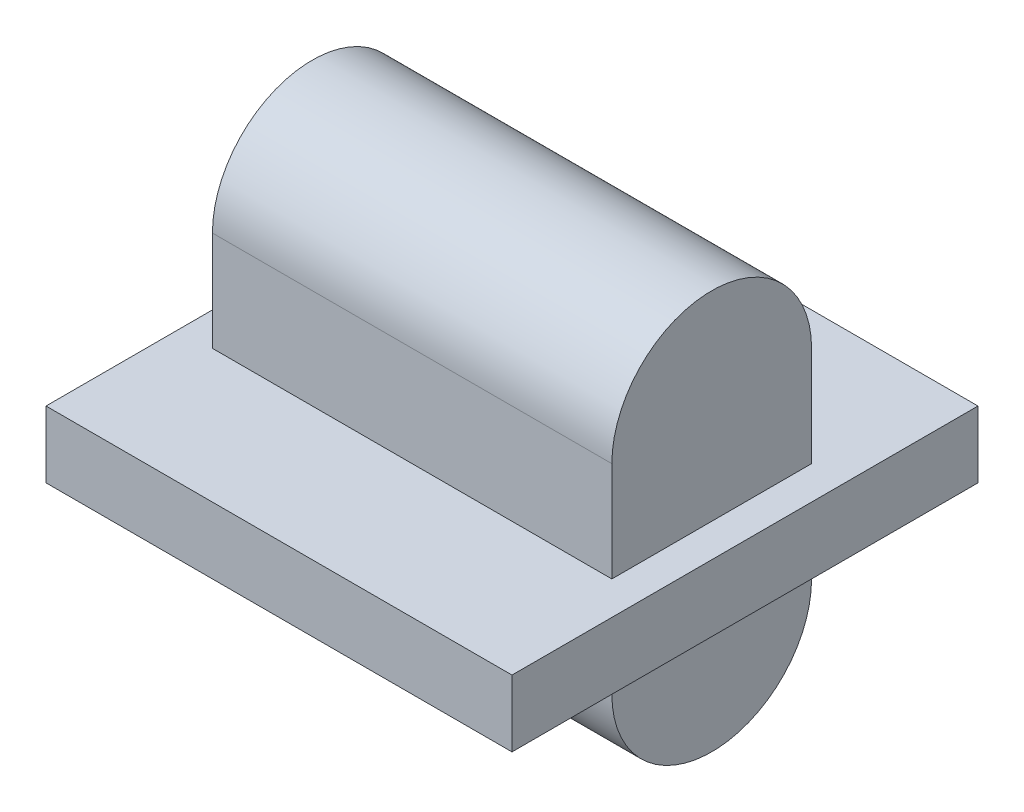
from build123d import *

# Parameters (mm, degrees)
SKETCH1_W           = 177.8
SKETCH1_H           = 177.8
BOSS_EXTRUDE1_DEPTH = 12.7
BOSS_EXTRUDE2_DEPTH = 76.2


with BuildPart() as part:
    # Sketch1 → Boss-Extrude1 (new, symmetric)
    with BuildSketch(Plane(origin=(0, 0, 0), x_dir=(1, 0, 0), z_dir=(0, 1, 0))):
        Rectangle(SKETCH1_W, SKETCH1_H)
    extrude(amount=BOSS_EXTRUDE1_DEPTH, both=True)

    # Sketch2 → Boss-Extrude2 (add, symmetric)
    with BuildSketch(Plane(origin=(0, 0, 0), x_dir=(0, 0, -1), z_dir=(1, 0, 0))):
        with BuildLine():
            Line((-38.1, -25.4), (-38.1, 50.8))
            ThreePointArc((-38.1, 50.8), (0, 88.9), (38.1, 50.8))
            Line((38.1, 50.8), (38.1, -25.4))
            ThreePointArc((38.1, -25.4), (0, -63.5), (-38.1, -25.4))
        make_face()
    extrude(amount=BOSS_EXTRUDE2_DEPTH, both=True)


solid = part.part
